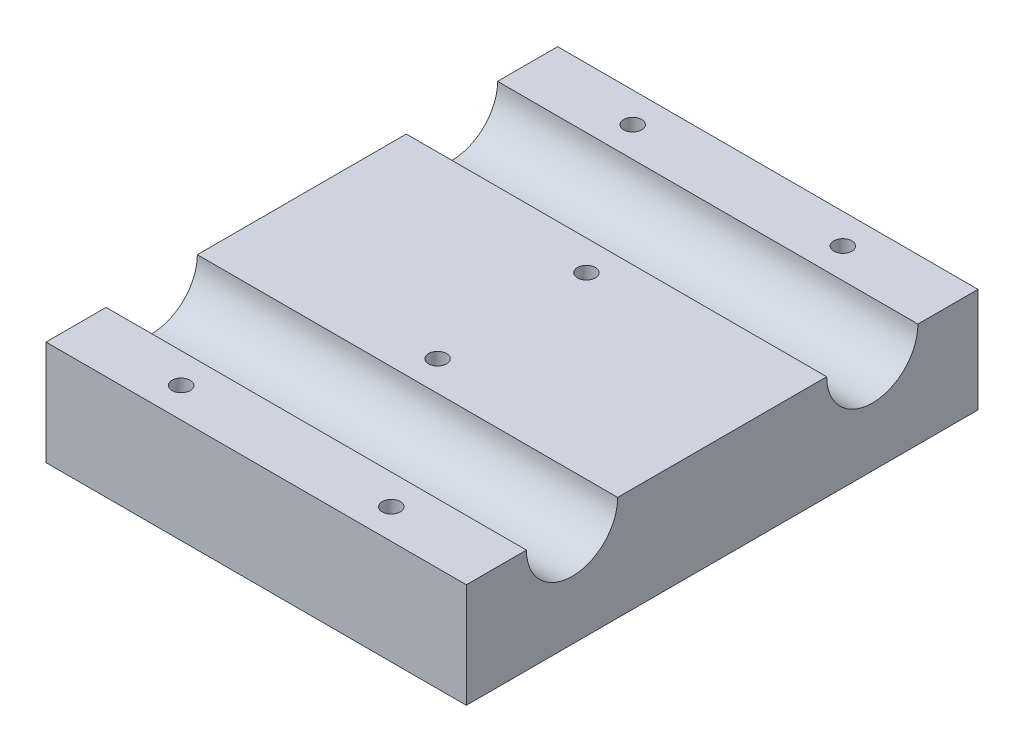
from build123d import *

# Parameters (mm, degrees)
BOSS_EXTRUDE1_DEPTH = 70
SKETCH2_R           = 1.5
CUT_EXTRUDE1_DEPTH  = 17.390666387


with BuildPart() as part:
    # Sketch1 → Boss-Extrude1 (new body)
    with BuildSketch(Plane.YZ):
        with BuildLine():
            ThreePointArc((17.390666387, -60), (9.790666387, -67.6), (17.390666387, -75.2))
            Line((17.390666387, -75.2), (17.390666387, -85.2))
            Line((17.390666387, -85.2), (0, -85.2))
            Line((0, -85.2), (0, 0))
            Line((0, 0), (17.390666387, 0))
            Line((17.390666387, 0), (17.390666387, -10))
            ThreePointArc((17.390666387, -10), (9.790666387, -17.6), (17.390666387, -25.2))
            Line((17.390666387, -25.2), (17.390666387, -60))
        make_face()
    extrude(amount=BOSS_EXTRUDE1_DEPTH)

    # Sketch2 → Cut-Extrude1 (cut)
    with BuildSketch(Plane(origin=(0, 17.390666387, 0), x_dir=(-1, 0, 0), z_dir=(0, 1, 0))):
        with Locations(Location((-52.5, -5, 0), (0, 0, 90))):
            Circle(SKETCH2_R)
        with Locations(Location((-17.5, -5, 0), (0, 0, 90))):
            Circle(SKETCH2_R)
        with Locations(Location((-52.5, -80.2, 0), (0, 0, 90))):
            Circle(SKETCH2_R)
        with Locations(Location((-17.5, -80.2, 0), (0, 0, 90))):
            Circle(SKETCH2_R)
        with Locations(Location((-35, -30.2, 0), (0, 0, 90))):
            Circle(SKETCH2_R)
        with Locations(Location((-35, -55, 0), (0, 0, 90))):
            Circle(SKETCH2_R)
    extrude(amount=-CUT_EXTRUDE1_DEPTH, mode=Mode.SUBTRACT)


solid = part.part
